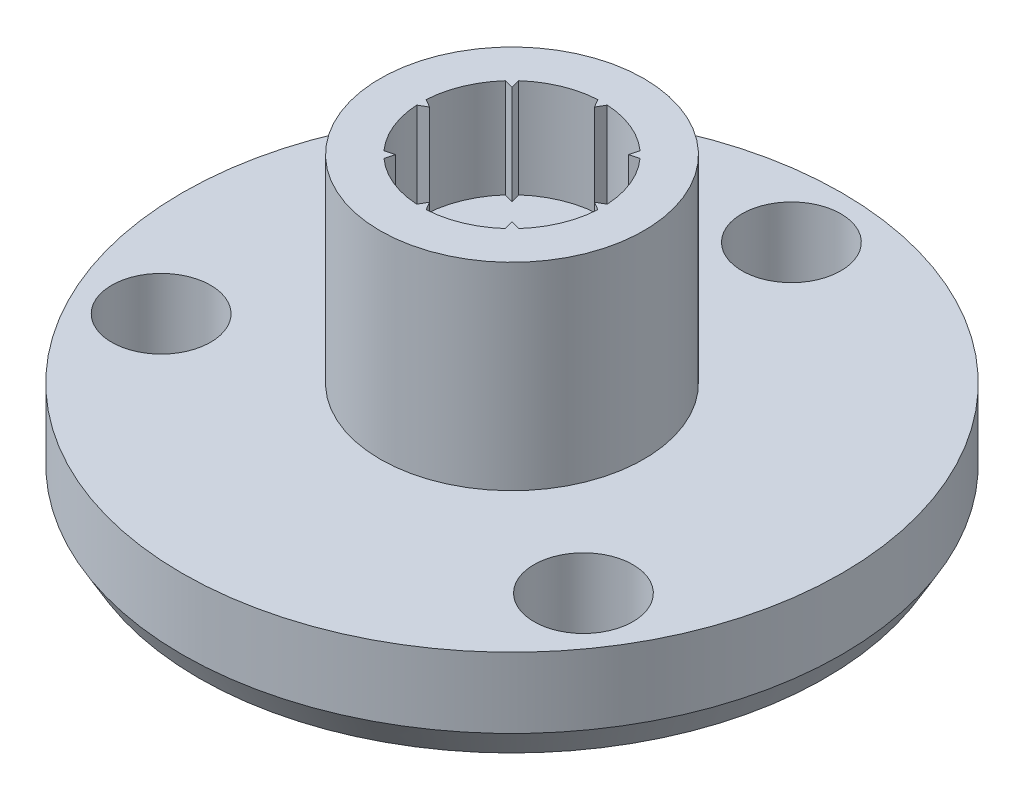
from build123d import *

# Parameters (mm, degrees)
SKETCH1_R           = 10
BOSS_EXTRUDE1_DEPTH = 3
SKETCH2_R           = 4
BOSS_EXTRUDE2_DEPTH = 3
SKETCH3_R           = 2.5
CUT_EXTRUDE1_DEPTH  = 5
SKETCH4_R           = 1.5
CUT_EXTRUDE2_DEPTH  = 3
SKETCH5_R           = 0.925
CUT_EXTRUDE3_DEPTH  = 1
CHAMFER1_SIZE       = 0.5
CHAMFER1_SIZE2      = 0.866025404
SKETCH6_R           = 4
BOSS_EXTRUDE3_DEPTH = 3
SKETCH7_R           = 2.75
CUT_EXTRUDE4_DEPTH  = 3
BOSS_EXTRUDE6_DEPTH = 3


with BuildPart() as part:
    # Sketch1 → Boss-Extrude1 (new body)
    with BuildSketch(Plane(origin=(0, 0, 0), x_dir=(1, 0, 0), z_dir=(0, 1, 0))):
        with Locations(Location((0, 0, 0), (0, 0, 270))):
            Circle(SKETCH1_R)
    extrude(amount=BOSS_EXTRUDE1_DEPTH)

    # Sketch2 → Boss-Extrude2 (add)
    with BuildSketch(Plane(origin=(0, 3, 0), x_dir=(1, 0, 0), z_dir=(0, 1, 0))):
        with Locations(Location((0, 0, 0), (0, 0, 270))):
            Circle(SKETCH2_R)
    extrude(amount=BOSS_EXTRUDE2_DEPTH)

    # Sketch3 → Cut-Extrude1 (cut)
    with BuildSketch(Plane.XZ):
        with Locations(Location((0, 0, 0), (0, 0, 270))):
            Circle(SKETCH3_R)
    extrude(amount=-CUT_EXTRUDE1_DEPTH, mode=Mode.SUBTRACT)

    # Sketch4 → Cut-Extrude2 (cut)
    with BuildSketch(Plane.XZ):
        with Locations(Location((-7.141738564, 3.5, 0), (0, 0, 270))):
            Circle(SKETCH4_R)
        with Locations(Location((6.601958195, 4.434927024, 0), (0, 0, 270))):
            Circle(SKETCH4_R)
        with Locations(Location((0.539780369, -7.934927024, 0), (0, 0, 270))):
            Circle(SKETCH4_R)
    extrude(amount=-CUT_EXTRUDE2_DEPTH, mode=Mode.SUBTRACT)

    # Sketch5 → Cut-Extrude3 (cut)
    with BuildSketch(Plane(origin=(0, 6, 0), x_dir=(1, 0, 0), z_dir=(0, 1, 0))):
        with Locations(Location((0, 0, 0), (0, 0, 270))):
            Circle(SKETCH5_R)
    extrude(amount=-CUT_EXTRUDE3_DEPTH, mode=Mode.SUBTRACT)

    # Chamfer1
    chamfer1_edges = [part.edges().sort_by_distance(p)[0] for p in [
        (0, 0, -10),
    ]]
    chamfer1_side = [part.faces().sort_by_distance(p)[0] for p in [
        (0, 0, -9.717157288),
    ]]
    chamfer(chamfer1_edges, length=CHAMFER1_SIZE, length2=CHAMFER1_SIZE2, reference=chamfer1_side[0])

    # Sketch6 → Boss-Extrude3 (add)
    with BuildSketch(Plane(origin=(0, 6, 0), x_dir=(1, 0, 0), z_dir=(0, 1, 0))):
        with Locations(Location((0, 0, 0), (0, 0, 270))):
            Circle(SKETCH6_R)
    extrude(amount=BOSS_EXTRUDE3_DEPTH)

    # Sketch7 → Cut-Extrude4 (cut)
    with BuildSketch(Plane(origin=(0, 9, 0), x_dir=(1, 0, 0), z_dir=(0, 1, 0))):
        with Locations(Location((0, 0, 0), (0, 0, 270))):
            Circle(SKETCH7_R)
    extrude(amount=-CUT_EXTRUDE4_DEPTH, mode=Mode.SUBTRACT)

    # Sketch8 → Boss-Extrude6 (add)
    with BuildSketch(Plane(origin=(0, 6, 0), x_dir=(1, 0, 0), z_dir=(0, 1, 0))):
        Polygon((0, 2.5), (0.216506351, 2.875), (-0.216506351, 2.875), align=None)
        Polygon((1.767766953, 1.767766953), (2.186025105, 1.879838887), (1.879838887, 2.186025105), align=None)
        Polygon((2.5, 0), (2.875, -0.216506351), (2.875, 0.216506351), align=None)
        Polygon((1.767766953, -1.767766953), (1.879838887, -2.186025105), (2.186025105, -1.879838887), align=None)
        Polygon((0, -2.5), (-0.216506351, -2.875), (0.216506351, -2.875), align=None)
        Polygon((-1.767766953, -1.767766953), (-2.186025105, -1.879838887), (-1.879838887, -2.186025105), align=None)
        Polygon((-2.5, 0), (-2.875, 0.216506351), (-2.875, -0.216506351), align=None)
        Polygon((-1.767766953, 1.767766953), (-1.879838887, 2.186025105), (-2.186025105, 1.879838887), align=None)
    extrude(amount=BOSS_EXTRUDE6_DEPTH)


solid = part.part
